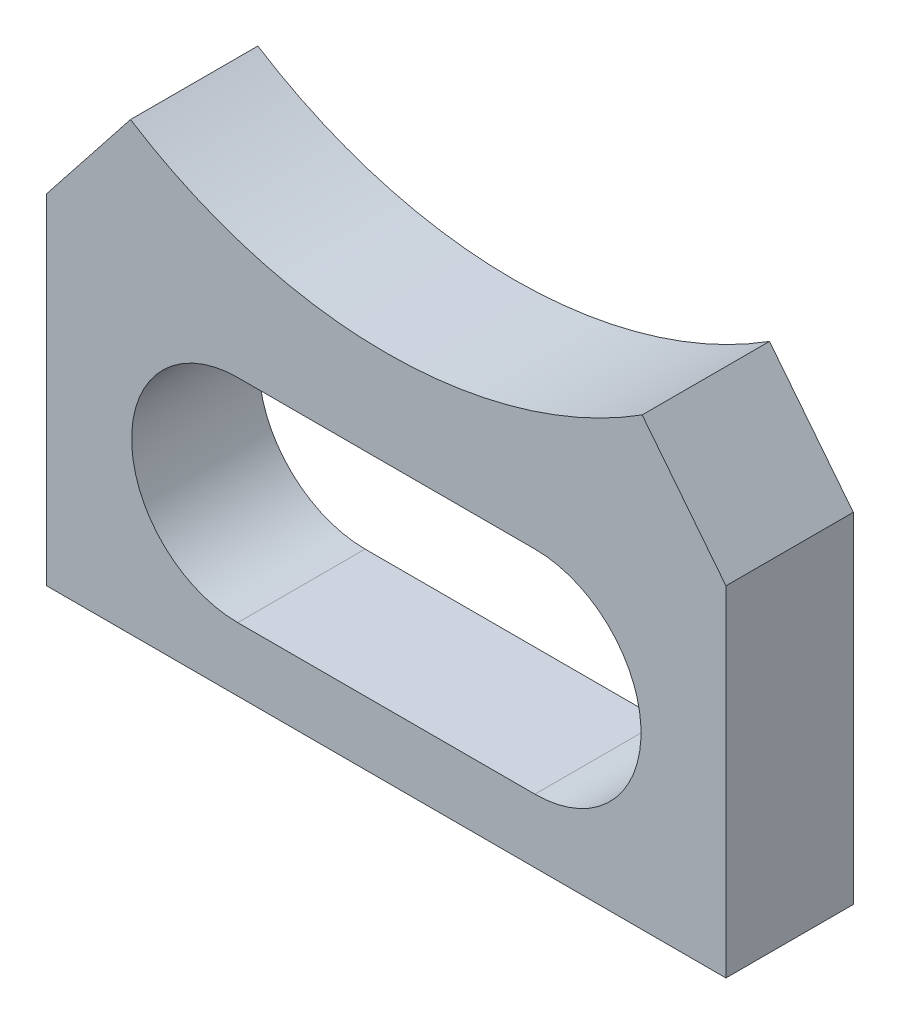
from build123d import *

# Parameters (mm, degrees)
BOSS_EXTRU_2_DEPTH = 6


with BuildPart() as part:
    # Esquisse1 → Boss.-Extru.2 (new body)
    with BuildSketch(Plane.XY):
        with BuildLine():
            Line((-16, 0), (16, 0))
            Line((16, 0), (16, 16))
            Line((16, 16), (12.051970793, 21))
            ThreePointArc((12.051970793, 21), (0, 17.5), (-12.051970793, 21))
            Line((-12.051970793, 21), (-16, 16))
            Line((-16, 16), (-16, 0))
        make_face()
        with BuildLine():
            Line((-7, 13), (7, 13))
            ThreePointArc((7, 13), (12, 8), (7, 3))
            Line((7, 3), (-7, 3))
            ThreePointArc((-7, 3), (-12, 8), (-7, 13))
        make_face(mode=Mode.SUBTRACT)
    extrude(amount=-BOSS_EXTRU_2_DEPTH)


solid = part.part
